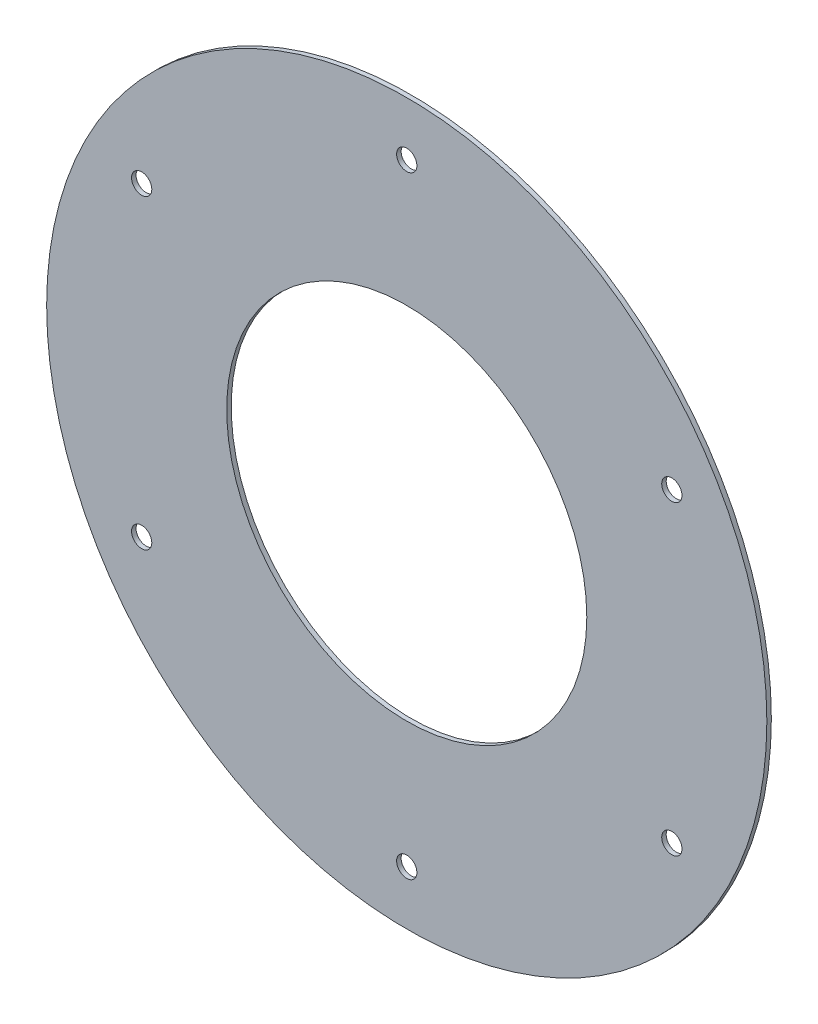
from build123d import *

# Parameters (mm, degrees)
SKETCH1_R               = 127
BOSS_EXTRUDE1_DEPTH     = 1.5875
F_1_4_CLEARANCE_HOLE1_D = 7.14248
CUT_EXTRUDE1_REACH      = 181.612
SKETCH4_R               = 63.5


with BuildPart() as part:
    # Sketch1 → Boss-Extrude1 (new body)
    with BuildSketch(Plane.XY):
        Circle(SKETCH1_R)
    extrude(amount=BOSS_EXTRUDE1_DEPTH)

    # 1/4 Clearance Hole1 (through all)
    with Locations(Plane.XY.offset(1.5875)):
        with Locations((-93.487442339, 53.975), (0, 107.95), (93.487442339, 53.975), (93.487442339, -53.975), (0, -107.95), (-93.487442339, -53.975)):
            Hole(F_1_4_CLEARANCE_HOLE1_D / 2)

    # Sketch4 → Cut-Extrude1 (cut, up to next)
    with BuildSketch(Plane.XY.offset(1.5875), mode=Mode.PRIVATE) as cut_extrude1_sk1:
        Circle(SKETCH4_R)
    cut_extrude1_tool1 = extrude(cut_extrude1_sk1.sketch, amount=-CUT_EXTRUDE1_REACH, mode=Mode.PRIVATE) & part.part
    add(cut_extrude1_tool1.solids().sort_by_distance((0, 0, 1.5875))[0], mode=Mode.SUBTRACT)


solid = part.part
